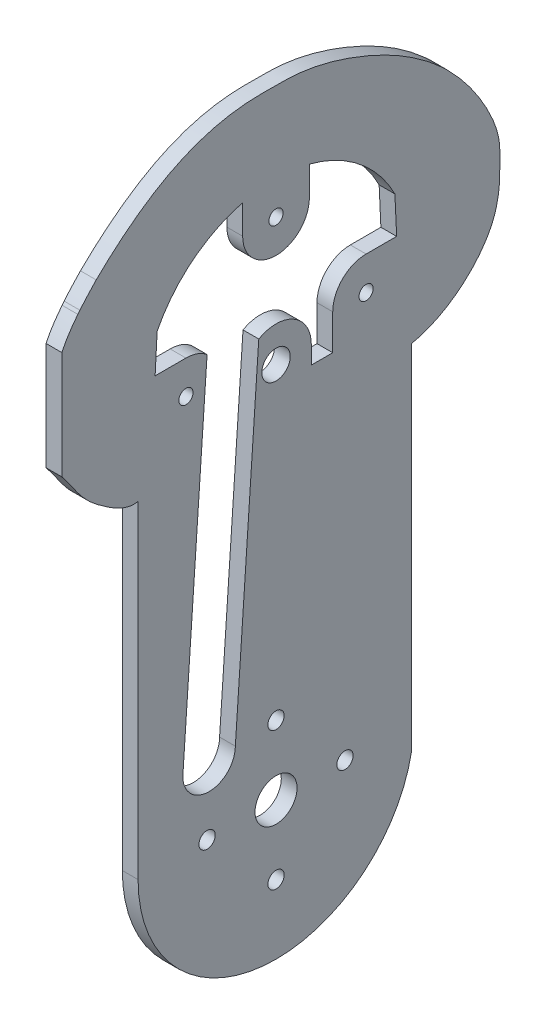
from build123d import *

# Parameters (mm, degrees)
ESQUISSE3_R        = 1.35255
ESQUISSE3_R_2      = 2.7051
ESQUISSE3_R_3      = 1.55
ESQUISSE3_R_4      = 4
BOSS_EXTRU_2_DEPTH = 3


with BuildPart() as part:
    # Esquisse3 → Boss.-Extru.2 (new body)
    with BuildSketch(Plane(origin=(0, 0, 0), x_dir=(0, 0, -1), z_dir=(1, 0, 0))):
        with BuildLine():
            Line((-40.60825, -16.144875), (-40.60825, -16.348305132))
            add(Edge.make_bspline(
                [(-40.60825, -16.348305132), (-40.365634485, -16.661193605), (-40.112338127, -16.96547542), (-39.63020507, -17.593748723), (-39.400688032, -17.917191992), (-38.719045939, -18.893089111), (-38.271947044, -19.549593057), (-37.338540998, -20.831006808), (-36.855460104, -21.458516341), (-36.059725811, -22.342477591), (-35.781944124, -22.627029047), (-35.202868212, -23.17718548), (-34.900674383, -23.443503751), (-33.971943166, -24.212706181), (-33.324405882, -24.685383849), (-32.010805282, -25.604549776), (-31.348089528, -26.055770333), (-30.303090708, -26.660610546), (-29.948270215, -26.848696892), (-29.222483721, -27.184971005), (-28.851412004, -27.333773538), (-28.083597976, -27.570691368), (-27.685315555, -27.657976057), (-27.090666934, -27.715403346), (-26.891908645, -27.722631025), (-26.592836888, -27.712936491), (-26.492990431, -27.706278992), (-26.292963936, -27.685632014), (-26.192732932, -27.670522326), (-26.092449031, -27.65425)],
                knots=[0, 0, 0, 0, 0.0625, 0.0625, 0.125, 0.125, 0.25, 0.25, 0.375, 0.375, 0.4375, 0.4375, 0.5, 0.5, 0.625, 0.625, 0.75, 0.75, 0.8125, 0.8125, 0.875, 0.875, 0.9375, 0.9375, 0.96875, 0.96875, 0.984375, 0.984375, 1, 1, 1, 1], degree=3))
            Line((-26.092449031, -27.65425), (-26.092449031, -90))
            ThreePointArc((-26.092449031, -90), (-2.31531669, -116.14013034), (25.954024412, -94.93864949))
            Line((25.954024412, -94.93864949), (25.954024412, -27.65425))
            add(Edge.make_bspline(
                [(25.954024412, -27.65425), (27.179118802, -27.419536533), (28.353377808, -27.051803075), (30.05705383, -26.34918771), (30.615126485, -26.089288473), (31.712904721, -25.521429223), (32.254485024, -25.212118815), (33.827204106, -24.230350536), (34.814025463, -23.502087852), (36.672007358, -21.907218093), (37.543320305, -21.040793316), (38.751902771, -19.623473398), (39.134714509, -19.134962989), (39.851014333, -18.131439591), (40.185535135, -17.615291382), (40.801362362, -16.550595558), (41.082635497, -16.002027673), (41.457015911, -15.150237789), (41.574249194, -14.86042264), (41.789713906, -14.277065554), (41.888049248, -13.98351322), (42.334688534, -12.506770959), (42.546239761, -11.296312151), (42.717568356, -9.451511475), (42.750611649, -8.83067761), (42.772859866, -7.900507946), (42.775360474, -7.590422151), (42.77555993, -6.970221998), (42.772087252, -6.66010067), (42.772087252, -6.35)],
                knots=[0, 0, 0, 0, 0.125, 0.125, 0.1875, 0.1875, 0.25, 0.25, 0.375, 0.375, 0.5, 0.5, 0.5625, 0.5625, 0.625, 0.625, 0.6875, 0.6875, 0.71875, 0.71875, 0.75, 0.75, 0.875, 0.875, 0.9375, 0.9375, 0.96875, 0.96875, 1, 1, 1, 1], degree=3))
            add(Edge.make_bspline(
                [(42.772087252, -6.35), (42.772087252, -5.874878454), (42.783792207, -5.398095979), (42.789657917, -4.447020546), (42.781867467, -3.973004463), (42.672546396, -2.563152451), (42.499179213, -1.637510108), (42.106282017, -0.267897459), (41.954068536, 0.185625042), (41.614819435, 1.087728793), (41.430081297, 1.530283034), (40.844911495, 2.839259084), (40.416604561, 3.689518781), (39.046783283, 6.190525131), (38.013123304, 7.787251584), (36.291657446, 10.082106977), (35.688509547, 10.830664164), (34.43654182, 12.281738953), (33.786199883, 12.985690235), (33.112075, 13.668565083)],
                knots=[0, 0, 0, 0, 0.0625, 0.0625, 0.125, 0.125, 0.25, 0.25, 0.3125, 0.3125, 0.375, 0.375, 0.5, 0.5, 0.75, 0.75, 0.875, 0.875, 1, 1, 1, 1], degree=3))
            add(Edge.make_bspline(
                [(33.112075, 13.668565083), (32.332207955, 14.539101946), (31.435060987, 15.277734234)],
                knots=[0, 0, 0, 1, 1, 1], degree=2))
            add(Edge.make_bspline(
                [(31.435060987, 15.277734234), (30.299691041, 16.309376592), (29.113704516, 17.275445235), (26.646604831, 19.084346085), (25.360475951, 19.928267183), (21.432297769, 22.265681686), (18.70167828, 23.563722979), (14.477833082, 25.213127628), (13.049229105, 25.71486416), (10.864398428, 26.369911185), (10.129061703, 26.571832136), (8.64156399, 26.936524394), (7.890831572, 27.098844789), (5.637990782, 27.512412208), (4.127431428, 27.693727696), (2.225306731, 27.768676851), (1.844136038, 27.775542931), (1.080940786, 27.779973661), (0.698904769, 27.777413484), (-0.446346689, 27.779064109), (-1.208874123, 27.797823926), (-2.732682239, 27.815308111), (-3.492085471, 27.806304753), (-5.004084105, 27.739990771), (-5.756994671, 27.684916502), (-8.006157922, 27.451797552), (-9.492662784, 27.204583891), (-11.701987236, 26.688775277), (-12.434852331, 26.491461598), (-13.894254142, 26.051929085), (-14.622118919, 25.807493497), (-16.765417144, 25.01223388), (-18.151500369, 24.400517874), (-20.847821735, 23.032525232), (-22.158708475, 22.277484827), (-24.716496252, 20.645447351), (-25.966430559, 19.7652326), (-28.39125747, 17.919703458), (-29.567431908, 16.954258357), (-31.287557173, 15.454109034), (-31.85380584, 14.945666112), (-32.972832423, 13.91291508), (-33.52577931, 13.388805977), (-34.066096443, 12.849822171)],
                knots=[0, 0, 0, 0, 0.0625, 0.0625, 0.125, 0.125, 0.25, 0.25, 0.3125, 0.3125, 0.34375, 0.34375, 0.375, 0.375, 0.4375, 0.4375, 0.453125, 0.453125, 0.46875, 0.46875, 0.5, 0.5, 0.53125, 0.53125, 0.5625, 0.5625, 0.625, 0.625, 0.65625, 0.65625, 0.6875, 0.6875, 0.75, 0.75, 0.8125, 0.8125, 0.875, 0.875, 0.9375, 0.9375, 0.96875, 0.96875, 1, 1, 1, 1], degree=3))
            add(Edge.make_bspline(
                [(-34.066096443, 12.849822171), (-35.159801618, 11.692162737), (-36.251081621, 10.53740284), (-37.166580532, 9.404947171)],
                knots=[0, 0, 0, 0, 1, 1, 1, 1], degree=3))
            ThreePointArc((-37.166580532, 9.404947171), (-37.363014685, 9.160281042), (-37.557796616, 8.914297524))
            add(Edge.make_bspline(
                [(-37.557796616, 8.914297524), (-38.142933539, 8.170182683), (-38.709522845, 7.412667282), (-39.741912272, 5.824816801), (-40.203133529, 4.998794666), (-40.60825, 4.142494902)],
                knots=[0, 0, 0, 0, 0.5, 0.5, 1, 1, 1, 1], degree=3))
            Line((-40.60825, 4.142494902), (-40.60825, -12.7))
            Line((-40.60825, -12.7), (-40.60825, -16.144875))
        make_face()
        with Locations((-16.9799, -14.9225)):
            Circle(ESQUISSE3_R, mode=Mode.SUBTRACT)
        with Locations((0.1651, -18.2245)):
            Circle(ESQUISSE3_R_2, mode=Mode.SUBTRACT)
        with Locations((17.3101, -14.9225)):
            Circle(ESQUISSE3_R, mode=Mode.SUBTRACT)
        with Locations((0.1651, 6.103472306)):
            Circle(ESQUISSE3_R, mode=Mode.SUBTRACT)
        with Locations((0.1651, -103.128774516)):
            Circle(ESQUISSE3_R_3, mode=Mode.SUBTRACT)
        with Locations((-12.956172959, -90)):
            Circle(ESQUISSE3_R_3, mode=Mode.SUBTRACT)
        with Locations((0.1651, -76.853281608)):
            Circle(ESQUISSE3_R_3, mode=Mode.SUBTRACT)
        with Locations((13.293874516, -90)):
            Circle(ESQUISSE3_R_3, mode=Mode.SUBTRACT)
        with Locations((0.1651, -90)):
            Circle(ESQUISSE3_R_4, mode=Mode.SUBTRACT)
        with BuildLine():
            Line((-6.1849, 6.103472306), (-6.1849, 11.646916554))
            ThreePointArc((-6.1849, 11.646916554), (-15.726599278, 6.86795928), (-22.463125, -1.408614826))
            Line((-22.463125, -1.408614826), (-22.848998606, -8.5725))
            Line((-22.848998606, -8.5725), (-16.9799, -8.5725))
            ThreePointArc((-16.9799, -8.5725), (-14.843492837, -8.942678562), (-12.956172959, -10.010054509))
            Line((-12.956172959, -10.010054509), (-17.532119892, -76.570733548))
            ThreePointArc((-17.532119892, -76.570733548), (-12.922094173, -82.243210377), (-7.579161123, -77.254984547))
            Line((-7.579161123, -77.254984547), (-3.118194312, -12.366780117))
            ThreePointArc((-3.118194312, -12.366780117), (3.559593485, -12.430510205), (6.880225, -18.2245))
            Line((6.880225, -18.2245), (6.880225, -21.669375))
            Line((6.880225, -21.669375), (10.9601, -21.669375))
            Line((10.9601, -21.669375), (10.9601, -14.9225))
            ThreePointArc((10.9601, -14.9225), (12.819971939, -10.432371939), (17.3101, -8.5725))
            Line((17.3101, -8.5725), (23.12590424, -8.5725))
            Line((23.12590424, -8.5725), (22.793325, -1.408614826))
            ThreePointArc((22.793325, -1.408614826), (16.056799278, 6.86795928), (6.5151, 11.646916554))
            Line((6.5151, 11.646916554), (6.5151, 6.103472306))
            ThreePointArc((6.5151, 6.103472306), (0.1651, -0.246527694), (-6.1849, 6.103472306))
        make_face(mode=Mode.SUBTRACT)
    extrude(amount=BOSS_EXTRU_2_DEPTH)


solid = part.part
